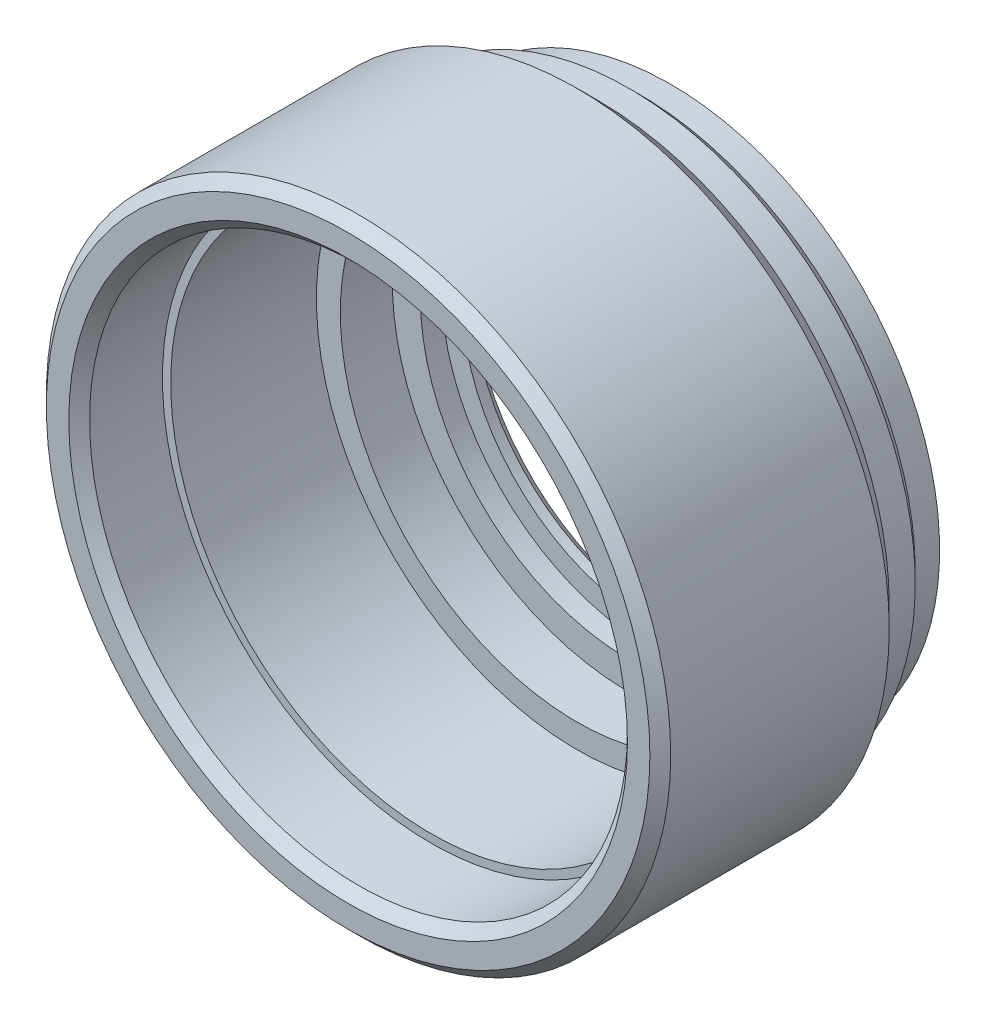
from build123d import *

# Parameters (mm, degrees)
SKETCH1_R           = 27.5
BOSS_EXTRUDE1_DEPTH = 7
SKETCH4_R           = 20.05
CUT_EXTRUDE1_DEPTH  = 5
SKETCH5_R           = 18.05
CUT_EXTRUDE2_DEPTH  = 40.210967853
BOSS_EXTRUDE2_START = 24
SKETCH6_R           = 30
SKETCH6_R_2         = 20.05
BOSS_EXTRUDE2_DEPTH = 24
SKETCH7_R           = 25.05
CUT_EXTRUDE3_DEPTH  = 22
SKETCH8_R           = 22.75
CUT_EXTRUDE4_DEPTH  = 5
SKETCH9_R           = 25.8445
CUT_EXTRUDE5_DEPTH  = 8
SKETCH10_OUTSIDE_W  = 80.068
SKETCH10_OUTSIDE_H  = 80.068
SKETCH10_OUTSIDE_R  = 25.8445
CUT_EXTRUDE6_DEPTH  = 3
CHAMFER3_SIZE       = 2
CHAMFER4_SIZE       = 1
CHAMFER5_SIZE       = 1


with BuildPart() as part:
    # Sketch1 → Boss-Extrude1 (new body)
    with BuildSketch(Plane.XY):
        Circle(SKETCH1_R)
    extrude(amount=BOSS_EXTRUDE1_DEPTH)

    # Sketch4 → Cut-Extrude1 (cut)
    with BuildSketch(Plane.XY.offset(7)):
        Circle(SKETCH4_R)
    extrude(amount=-CUT_EXTRUDE1_DEPTH, mode=Mode.SUBTRACT)

    # Sketch5 → Cut-Extrude2 (cut, through all)
    with BuildSketch(Plane.XY.offset(2)):
        Circle(SKETCH5_R)
    extrude(amount=-CUT_EXTRUDE2_DEPTH, mode=Mode.SUBTRACT)

    # Sketch6 → Boss-Extrude2 (add)
    with BuildSketch(Plane.XY.offset(7).offset(BOSS_EXTRUDE2_START)):
        Circle(SKETCH6_R)
        Circle(SKETCH6_R_2, mode=Mode.SUBTRACT)
    extrude(amount=-BOSS_EXTRUDE2_DEPTH)

    # Sketch7 → Cut-Extrude3 (cut)
    with BuildSketch(Plane.XY.offset(31)):
        Circle(SKETCH7_R)
    extrude(amount=-CUT_EXTRUDE3_DEPTH, mode=Mode.SUBTRACT)

    # Sketch8 → Cut-Extrude4 (cut)
    with BuildSketch(Plane.XY.offset(9)):
        Circle(SKETCH8_R)
    extrude(amount=-CUT_EXTRUDE4_DEPTH, mode=Mode.SUBTRACT)

    # Sketch9 → Cut-Extrude5 (cut)
    with BuildSketch(Plane.XY.offset(31)):
        Circle(SKETCH9_R)
    extrude(amount=-CUT_EXTRUDE5_DEPTH, mode=Mode.SUBTRACT)

    # Sketch10 outside → Cut-Extrude6 (cut)
    with BuildSketch(Plane(origin=(0, 0, 0), x_dir=(-1, 0, 0), z_dir=(0, 0, -1))):
        Rectangle(SKETCH10_OUTSIDE_W, SKETCH10_OUTSIDE_H)
        with Locations(Location((0, 0, 0), (0, 0, 180))):
            Circle(SKETCH10_OUTSIDE_R, mode=Mode.SUBTRACT)
    extrude(amount=-CUT_EXTRUDE6_DEPTH, mode=Mode.SUBTRACT)

    # Chamfer3
    chamfer3_edges = [part.edges().sort_by_distance(p)[0] for p in [
        (-30, 0, 7),
    ]]
    chamfer(chamfer3_edges, length=CHAMFER3_SIZE)

    # Chamfer4
    chamfer4_edges = [part.edges().sort_by_distance(p)[0] for p in [
        (-27.5, 0, 3),
    ]]
    chamfer(chamfer4_edges, length=CHAMFER4_SIZE)

    # Chamfer5
    chamfer5_edges = [part.edges().sort_by_distance(p)[0] for p in [
        (-18.05, 0, 0),
        (-30, 0, 31),
        (-25.8445, 0, 31),
    ]]
    chamfer(chamfer5_edges, length=CHAMFER5_SIZE)


solid = part.part
